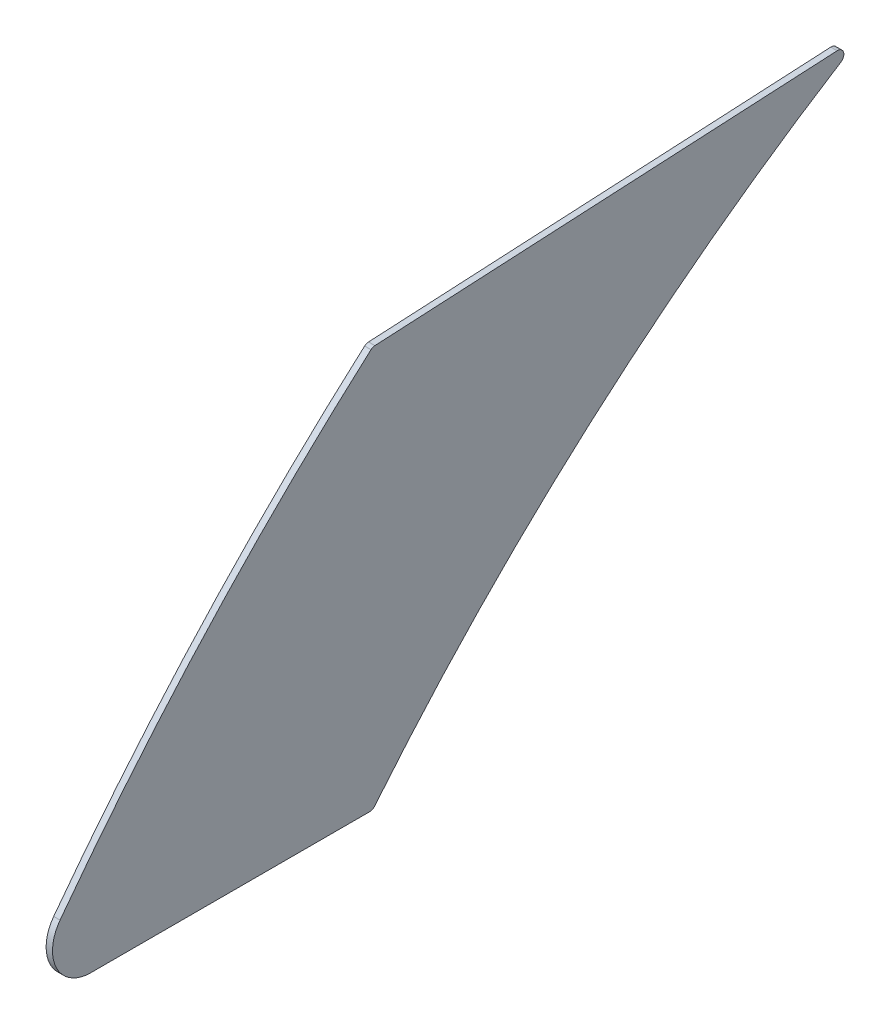
from build123d import *

# Parameters (mm, degrees)
BOSS_EXTRUDE1_DEPTH = 1


with BuildPart() as part:
    # Sketch1 → Boss-Extrude1 (new body)
    with BuildSketch(Plane(origin=(0, 0, 0), x_dir=(0, 0, -1), z_dir=(1, 0, 0))):
        with BuildLine():
            Line((0.348531139, 0.018265743), (72.985797314, 3.825023556))
            ThreePointArc((72.985797314, 3.825023556), (73.991753866, 3.127405248), (73.568595626, 1.978685529))
            ThreePointArc((73.568595626, 1.978685529), (34.286561941, -27.324507504), (0.299617848, -62.632338413))
            ThreePointArc((0.299617848, -62.632338413), (-0.046319499, -62.903420836), (-0.475074433, -63))
            Line((-0.475074433, -63), (-44.305483114, -63))
            ThreePointArc((-44.305483114, -63), (-49.666853492, -59.693642083), (-49.119354071, -53.418569223))
            ThreePointArc((-49.119354071, -53.418569223), (-26.066145165, -25.561463063), (-0.261851868, -0.231495595))
            ThreePointArc((-0.261851868, -0.231495595), (0.022157357, -0.054848295), (0.348531139, 0.018265743))
        make_face()
    extrude(amount=BOSS_EXTRUDE1_DEPTH)


solid = part.part
